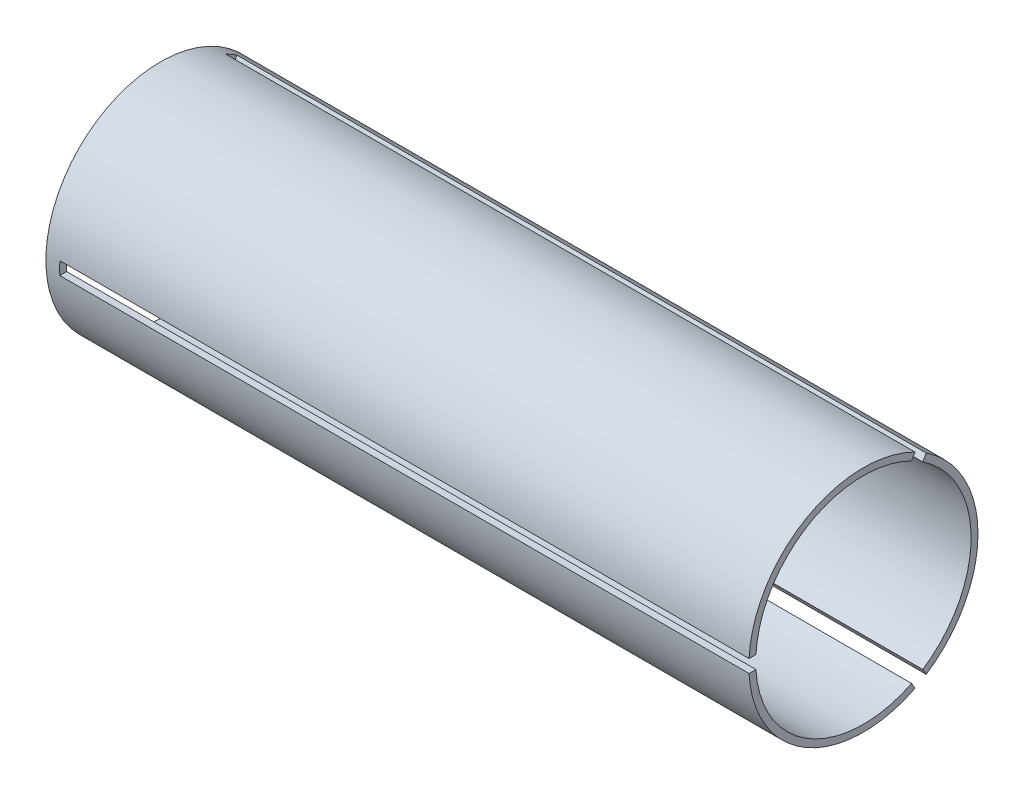
from build123d import *

# Parameters (mm, degrees)
SKETCH1_R           = 42.2275
SKETCH1_R_2         = 39.6875
BOSS_EXTRUDE1_DEPTH = 259.08
SKETCH2_W           = 4.7625
SKETCH2_H           = 254
CUT_EXTRUDE1_DEPTH  = 266.873597622
CIRPATTERN1_COUNT   = 3


with BuildPart() as part:
    # Sketch1 → Boss-Extrude1 (new body)
    with BuildSketch(Plane.YZ):
        with Locations(Location((0, 0, 0), (0, 0, 270))):
            Circle(SKETCH1_R)
        with Locations(Location((0, 0, 0), (0, 0, 270))):
            Circle(SKETCH1_R_2, mode=Mode.SUBTRACT)
    extrude(amount=BOSS_EXTRUDE1_DEPTH)

    # Sketch2 → Cut-Extrude1 (cut, through all)
    with BuildSketch(Plane(origin=(0, 0, 0), x_dir=(0, 1, 0), z_dir=(0, 0, 1))):
        with Locations((0, -132.08)):
            Rectangle(SKETCH2_W, SKETCH2_H)
    cut_extrude1 = extrude(amount=CUT_EXTRUDE1_DEPTH, mode=Mode.SUBTRACT)

    # CirPattern1: Cut-Extrude1 ×3 about axis
    cirpattern1_axis = Axis((0, 0, 0), (1, 0, 0))
    for i in range(1, CIRPATTERN1_COUNT):
        add(cut_extrude1.rotate(cirpattern1_axis, i * 360 / CIRPATTERN1_COUNT), mode=Mode.SUBTRACT)


solid = part.part
